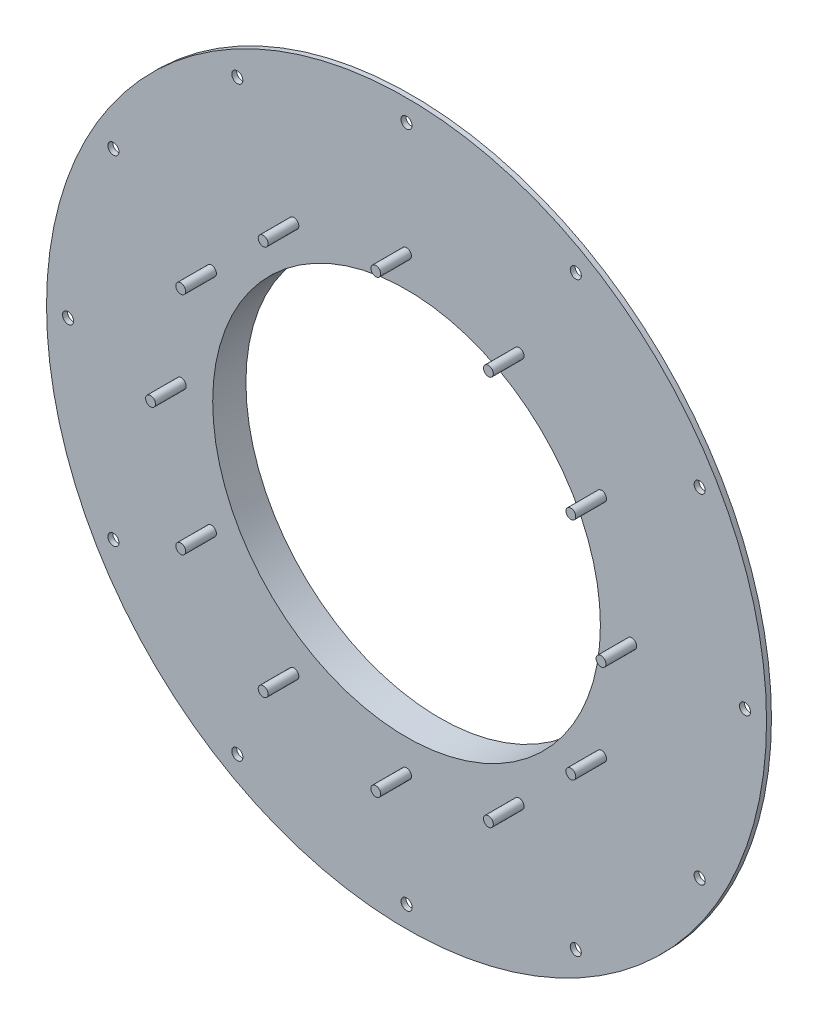
from build123d import *
from build123d.topology import SkipClean

# Parameters (mm, degrees)
SKETCH1_R           = 292.5
SKETCH1_R_2         = 157.5
BOSS_EXTRUDE1_DEPTH = 4
SKETCH2_R           = 4.5
CUT_EXTRUDE1_DEPTH  = 414.676806215
CIRPATTERN1_COUNT   = 12
SKETCH3_R           = 4
BOSS_EXTRUDE2_DEPTH = 25
CIRPATTERN2_COUNT   = 12
EXTRUDE_THIN1_START = 23
SKETCH4_R           = 159.5
SKETCH4_R_2         = 157.5
EXTRUDE_THIN1_DEPTH = 23


with BuildPart() as part:
    # Sketch1 → Boss-Extrude1 (new body)
    with BuildSketch(Plane.XY):
        Circle(SKETCH1_R)
        Circle(SKETCH1_R_2, mode=Mode.SUBTRACT)
    extrude(amount=BOSS_EXTRUDE1_DEPTH)

    # Sketch2 → Cut-Extrude1 (cut, through all)
    with BuildSketch(Plane.XY.offset(4)):
        with Locations((0, 275)):
            Circle(SKETCH2_R)
    cut_extrude1 = extrude(amount=-CUT_EXTRUDE1_DEPTH, mode=Mode.SUBTRACT)

    # CirPattern1: Cut-Extrude1 ×12 about axis
    cirpattern1_axis = Axis((0, 0, 0), (0, 0, 1))
    for i in range(1, CIRPATTERN1_COUNT):
        add(cut_extrude1.rotate(cirpattern1_axis, i * 360 / CIRPATTERN1_COUNT), mode=Mode.SUBTRACT)

    # Sketch3 → Boss-Extrude2 (add)
    with BuildSketch(Plane.XY.offset(4)):
        with Locations((0, 183)):
            Circle(SKETCH3_R)
    boss_extrude2 = extrude(amount=BOSS_EXTRUDE2_DEPTH)

    # CirPattern2: Boss-Extrude2 ×12 about axis
    cirpattern2_axis = Axis((0, 0, 0), (0, 0, 1))
    for i in range(1, CIRPATTERN2_COUNT):
        add(boss_extrude2.rotate(cirpattern2_axis, i * 360 / CIRPATTERN2_COUNT))

    # Sketch4 → Extrude-Thin1 (add)
    with SkipClean():  # the faces are left unmerged after this step: merging them gives an invalid solid
        with BuildSketch(Plane(origin=(0, 0, 0), x_dir=(-1, 0, 0), z_dir=(0, 0, -1)).offset(EXTRUDE_THIN1_START)):
            Circle(SKETCH4_R)
            Circle(SKETCH4_R_2, mode=Mode.SUBTRACT)
        extrude(amount=-EXTRUDE_THIN1_DEPTH)


solid = part.part
